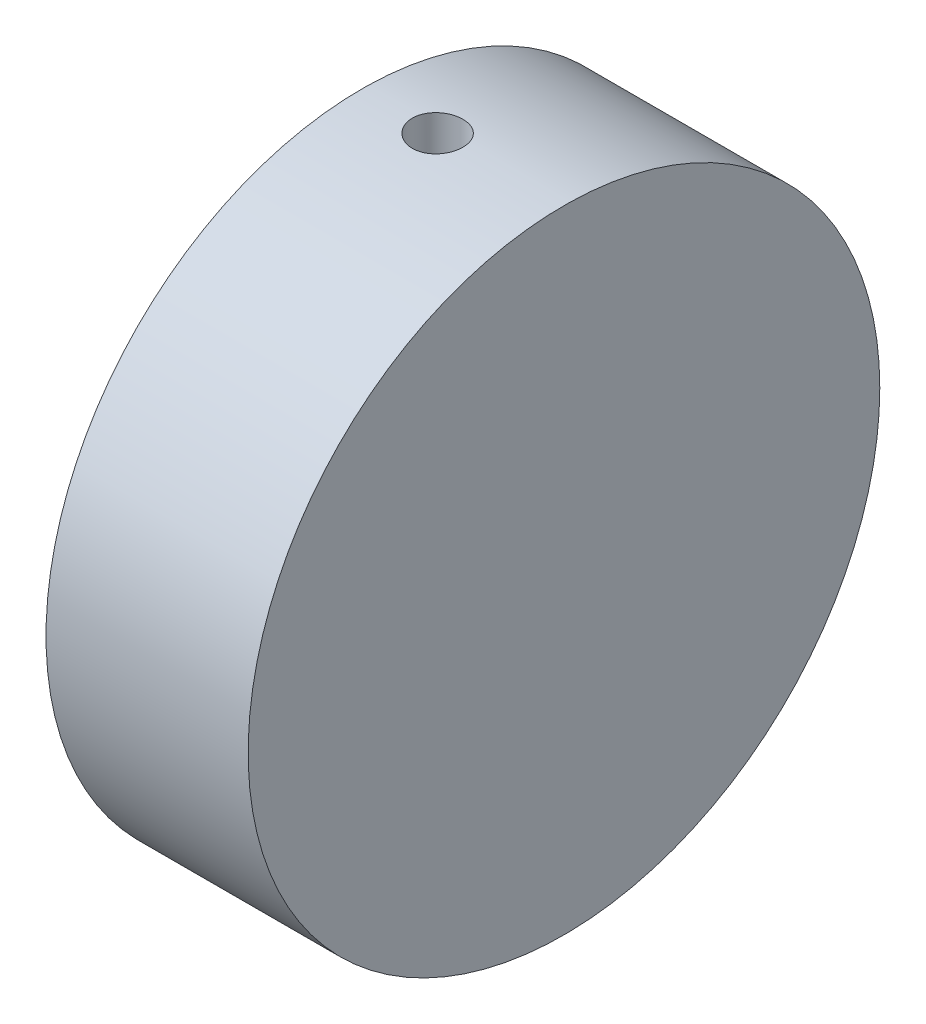
from build123d import *

# Parameters (mm, degrees)
SKETCH_1_R                      = 12.5
EXTRUDE_1_DEPTH                 = 8
SKETCH_2_R                      = 3.2
CUT_EXTRUDE_1_DEPTH             = 6
CUT_EXTRUDE_2_REACH             = 21.404
SKETCH_3_R                      = 1
CUT_EXTRUDE_2_DIRECTION_2_REACH = 21.404


with BuildPart() as part:
    # 草图1 → 凸台-拉伸1 (new body)
    with BuildSketch(Plane(origin=(0, 0, 0), x_dir=(0, 0, -1), z_dir=(1, 0, 0))):
        Circle(SKETCH_1_R)
    extrude(amount=EXTRUDE_1_DEPTH)

    # 草图2 → 切除-拉伸1 (cut)
    with BuildSketch(Plane.ZY):
        Circle(SKETCH_2_R)
    extrude(amount=-CUT_EXTRUDE_1_DEPTH, mode=Mode.SUBTRACT)

    # 草图3 → 切除-拉伸2 (cut, up to next)
    with BuildSketch(Plane(origin=(0, 0, 0), x_dir=(1, 0, 0), z_dir=(0, 1, 0)), mode=Mode.PRIVATE) as cut_extrude_2_sk1:
        with Locations(Location((3, 0, 0), (0, 0, 270))):
            Circle(SKETCH_3_R)
    cut_extrude_2_tool1 = extrude(cut_extrude_2_sk1.sketch, amount=-CUT_EXTRUDE_2_REACH, mode=Mode.PRIVATE) & part.part
    add(cut_extrude_2_tool1.solids().sort_by_distance((3, 0, 0))[0], mode=Mode.SUBTRACT)

    # 草图3 → 切除-拉伸2 direction 2 (cut, up to next)
    with BuildSketch(Plane(origin=(0, 0, 0), x_dir=(1, 0, 0), z_dir=(0, 1, 0)), mode=Mode.PRIVATE) as cut_extrude_2_direction_2_sk1:
        with Locations(Location((3, 0, 0), (0, 0, 270))):
            Circle(SKETCH_3_R)
    cut_extrude_2_direction_2_tool1 = extrude(cut_extrude_2_direction_2_sk1.sketch, amount=CUT_EXTRUDE_2_DIRECTION_2_REACH, mode=Mode.PRIVATE) & part.part
    add(cut_extrude_2_direction_2_tool1.solids().sort_by_distance((3, 0, 0))[0], mode=Mode.SUBTRACT)


solid = part.part
